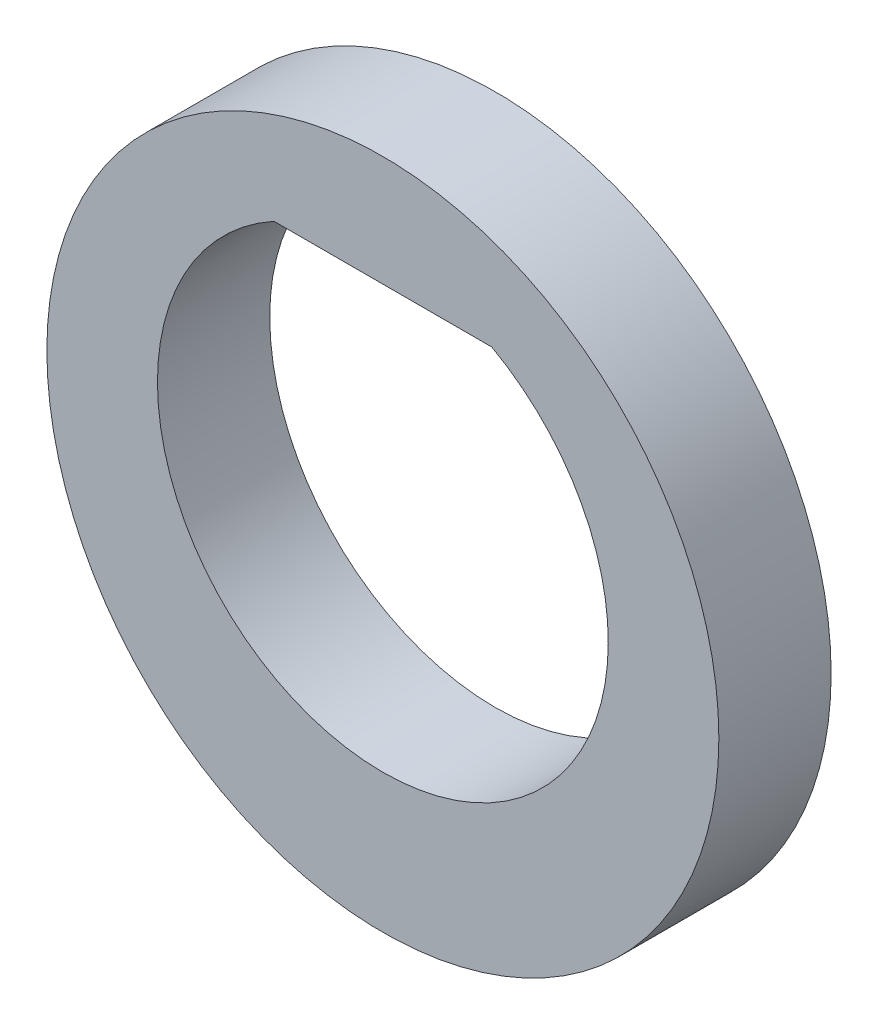
from build123d import *

# Parameters (mm, degrees)
SKETCH_1_R      = 5.985
EXTRUDE_1_DEPTH = 2


with BuildPart() as part:
    # 草图1 → 凸台-拉伸1 (new body)
    with BuildSketch(Plane.XY):
        with Locations((0, -1)):
            Circle(SKETCH_1_R)
        with BuildLine():
            Line((-1.940360791, 3.015), (1.940360791, 3.015))
            ThreePointArc((1.940360791, 3.015), (0, -4.515), (-1.940360791, 3.015))
        make_face(mode=Mode.SUBTRACT)
    extrude(amount=EXTRUDE_1_DEPTH)


solid = part.part
